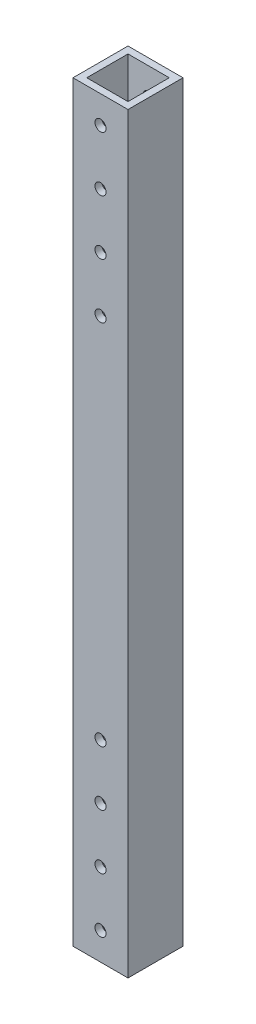
from build123d import *

# Parameters (mm, degrees)
SKETCH1_W              = 25.4
SKETCH1_H              = 25.4
SKETCH1_W_2            = 19.05
SKETCH1_H_2            = 19.05
BOSS_EXTRUDE1_DEPTH    = 347.345
F_10_CLEARANCE_HOLE1_D = 5.1054
F_10_CLEARANCE_HOLE2_D = 5.1054


with BuildPart() as part:
    # Sketch1 → Boss-Extrude1 (new body)
    with BuildSketch(Plane(origin=(0, 0, 0), x_dir=(1, 0, 0), z_dir=(0, 1, 0))):
        Rectangle(SKETCH1_W, SKETCH1_H)
        Rectangle(SKETCH1_W_2, SKETCH1_H_2, mode=Mode.SUBTRACT)
    extrude(amount=BOSS_EXTRUDE1_DEPTH)

    # #10 Clearance Hole1 (through all)
    with Locations(Plane.XY.offset(12.7)):
        with Locations((0, 283.845), (0, 12.7), (0, 38.1), (0, 63.5), (0, 334.645), (0, 309.245)):
            Hole(F_10_CLEARANCE_HOLE1_D / 2)

    # #10 Clearance Hole2 (through all)
    with Locations(Plane(origin=(-1665.705302189, -475.547296868, 15.875), x_dir=(1, 0, 0), z_dir=(0, 0, 1))):
        with Locations((1665.705300516, 564.447296868), (1665.705300516, 733.992296868)):
            Hole(F_10_CLEARANCE_HOLE2_D / 2)


solid = part.part
